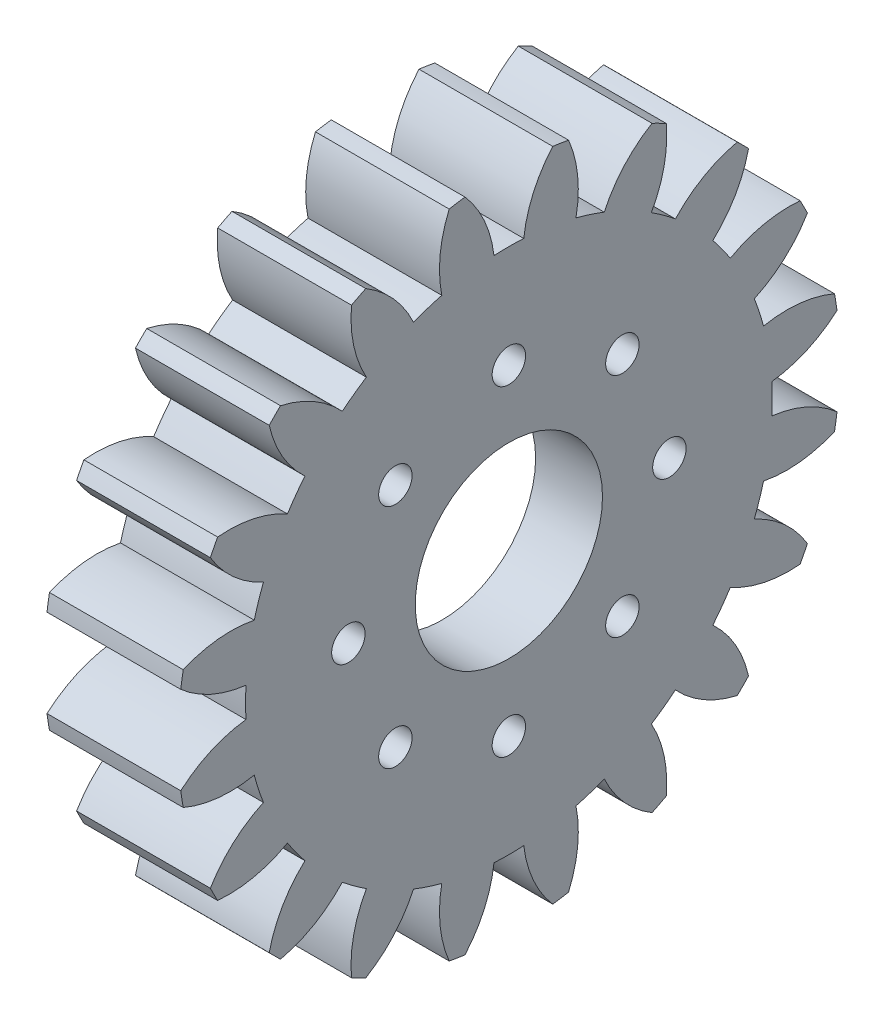
from build123d import *

# Parameters (mm, degrees)
BASPROSKE_W         = 10
BASPROSKE_H         = 24.75
TOOTHCUT_DEPTH      = 37.402266413
TEETHCUTS_COUNT     = 20
TEETHCUTS_ANGLE     = 342
BORSKE_R            = 15
BORE_DEPTH          = 50.0000508
SKETCH1_R           = 15
BOSS_EXTRUDE1_DEPTH = 5
SKETCH2_R           = 7
CUT_EXTRUDE1_DEPTH  = 5
SKETCH3_R           = 1.25
CUT_EXTRUDE2_DEPTH  = 5


with BuildPart() as part:
    # BasProSke → Base-Revolve (revolve)
    with BuildSketch(Plane(origin=(0, 0, 0), x_dir=(1, 0, 0), z_dir=(0, 1, 0)), mode=Mode.PRIVATE) as base_revolve_sk:
        with Locations((5, 12.375)):
            Rectangle(BASPROSKE_W, BASPROSKE_H)
    revolve(base_revolve_sk.sketch.rotate(Axis((-10, 0, 0), (1, 0, 0)), 180), axis=Axis((-10, 0, 0), (1, 0, 0)))

    # TooCutSke → ToothCut (cut, through all)
    with BuildSketch(Plane(origin=(0, 0, 0), x_dir=(0, 0, -1), z_dir=(1, 0, 0))):
        with BuildLine():
            ThreePointArc((1.111948432, 19.655071939), (0, 19.6865), (-1.111948432, 19.655071939))
            ThreePointArc((-1.111948432, 19.655071939), (-1.832349961, 22.271720111), (-3.300041734, 24.55463642))
            ThreePointArc((-3.300041734, 24.55463642), (0, 24.7754), (3.300041734, 24.55463642))
            ThreePointArc((3.300041734, 24.55463642), (1.832349961, 22.271720111), (1.111948432, 19.655071939))
        make_face()
    toothcut = extrude(amount=TOOTHCUT_DEPTH, mode=Mode.SUBTRACT)

    # TeethCuts: ToothCut ×20 about axis
    teethcuts_axis = Axis((-10, 0, 0), (1, 0, 0))
    for i in range(1, TEETHCUTS_COUNT):
        add(toothcut.rotate(teethcuts_axis, i * TEETHCUTS_ANGLE / (TEETHCUTS_COUNT - 1)), mode=Mode.SUBTRACT)

    # BorSke → Bore (cut, symmetric)
    with BuildSketch(Plane(origin=(0, 0, 0), x_dir=(0, 0, -1), z_dir=(1, 0, 0))):
        with Locations(Location((0, 0, 0), (0, 0, 180))):
            Circle(BORSKE_R)
    extrude(amount=BORE_DEPTH, both=True, mode=Mode.SUBTRACT)

    # Sketch1 → Boss-Extrude1 (add)
    with BuildSketch(Plane(origin=(10, 0, 0), x_dir=(0, 0, -1), z_dir=(1, 0, 0))):
        Circle(SKETCH1_R)
    extrude(amount=-BOSS_EXTRUDE1_DEPTH)

    # Sketch2 → Cut-Extrude1 (cut)
    with BuildSketch(Plane(origin=(10, 0, 0), x_dir=(0, 0, -1), z_dir=(1, 0, 0))):
        Circle(SKETCH2_R)
    extrude(amount=-CUT_EXTRUDE1_DEPTH, mode=Mode.SUBTRACT)

    # Sketch3 → Cut-Extrude2 (cut)
    with BuildSketch(Plane(origin=(10, 0, 0), x_dir=(0, 0, -1), z_dir=(1, 0, 0))):
        with Locations((0, 12)):
            Circle(SKETCH3_R)
        with Locations((8.485281374, 8.485281374)):
            Circle(SKETCH3_R)
        with Locations((12, 0)):
            Circle(SKETCH3_R)
        with Locations((8.485281374, -8.485281374)):
            Circle(SKETCH3_R)
        with Locations((0, -12)):
            Circle(SKETCH3_R)
        with Locations((-8.485281374, -8.485281374)):
            Circle(SKETCH3_R)
        with Locations((-12, 0)):
            Circle(SKETCH3_R)
        with Locations((-8.485281374, 8.485281374)):
            Circle(SKETCH3_R)
    extrude(amount=-CUT_EXTRUDE2_DEPTH, mode=Mode.SUBTRACT)


solid = part.part
